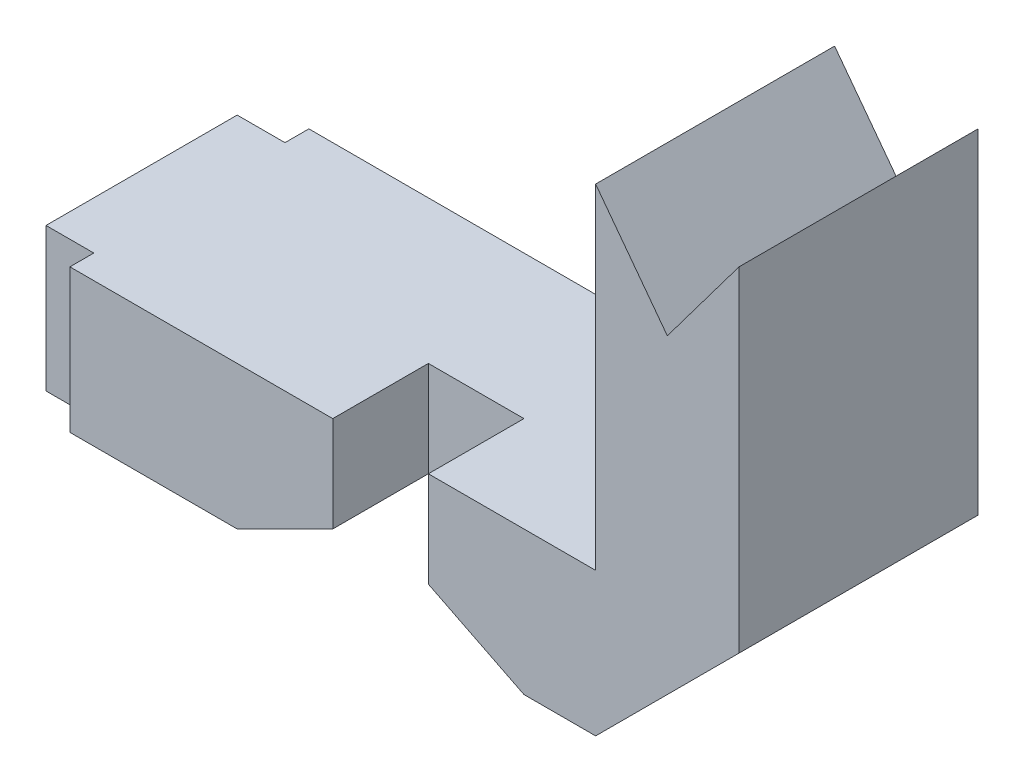
from build123d import *

# Parameters (mm, degrees)
EXTRUDE_1_DEPTH     = 50
CUT_EXTRUDE_1_DEPTH = 173.916164658
SKETCH_3_W          = 20
SKETCH_3_H          = 20
CUT_EXTRUDE_2_DEPTH = 20
SKETCH_5_W          = 10
SKETCH_5_H          = 5
CUT_EXTRUDE_3_DEPTH = 173.916164658


with BuildPart() as part:
    # Эскиз1 → Бобышка-Вытянуть1 (new body)
    with BuildSketch(Plane.XY):
        Polygon((-150, 0), (-30, 0), (-30, 70), (-15, 50), (0, 70), (0, 0), (-30, -30), (-150, -30), align=None)
    extrude(amount=EXTRUDE_1_DEPTH)

    # Эскиз2 → Вырез-Вытянуть1 (cut, through all)
    with BuildSketch(Plane.XY.offset(50)):
        Polygon((-105, -30), (-75, -15), (-45, -30), align=None)
    extrude(amount=-CUT_EXTRUDE_1_DEPTH, mode=Mode.SUBTRACT)

    # Эскиз3 → Вырез-Вытянуть2 (cut)
    with BuildSketch(Plane.XY.offset(50)):
        with Locations((-75, -10)):
            Rectangle(SKETCH_3_W, SKETCH_3_H)
    extrude(amount=-CUT_EXTRUDE_2_DEPTH, mode=Mode.SUBTRACT)

    # Эскиз5 → Вырез-Вытянуть3 (cut, through all)
    with BuildSketch(Plane(origin=(0, 0, 0), x_dir=(1, 0, 0), z_dir=(0, 1, 0))):
        with Locations((-145, -2.5)):
            Rectangle(SKETCH_5_W, SKETCH_5_H)
        with Locations((-145, -47.5)):
            Rectangle(SKETCH_5_W, SKETCH_5_H)
    extrude(amount=-CUT_EXTRUDE_3_DEPTH, mode=Mode.SUBTRACT)


solid = part.part
